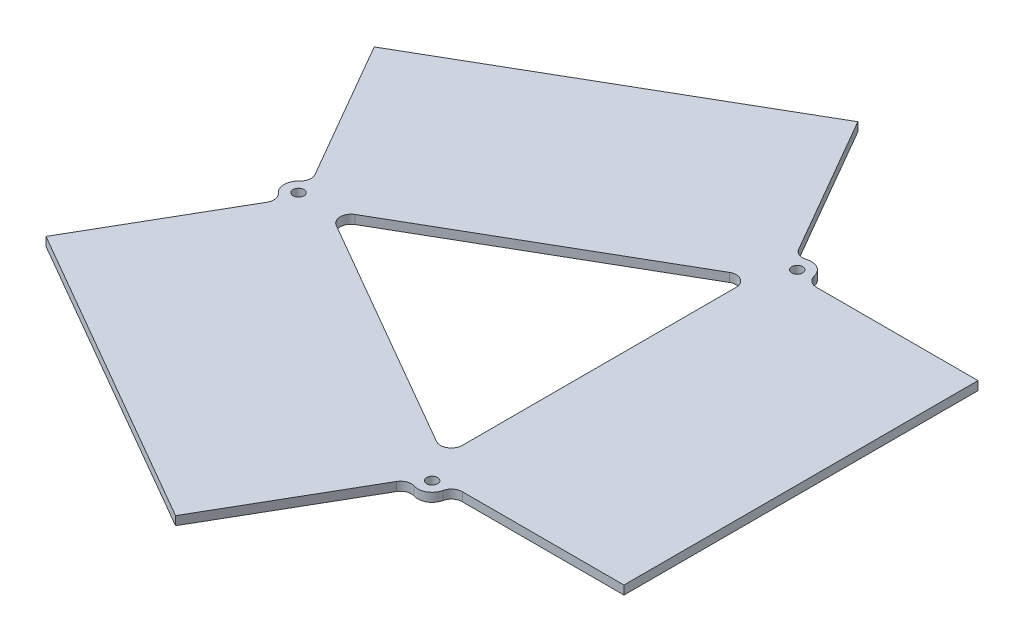
from build123d import *

# Parameters (mm, degrees)
SKETCH1_R           = 1.25
BOSS_EXTRUDE1_DEPTH = 2
FILLET1_R           = 2.5


with BuildPart() as part:
    # Sketch1 → Boss-Extrude1 (new body)
    with BuildSketch(Plane(origin=(0, 0, 0), x_dir=(1, 0, 0), z_dir=(0, 1, 0))):
        with BuildLine():
            Line((-103.965757813, 67.162425071), (-33.817700106, 107.662425071))
            Line((-33.817700106, 107.662425071), (-14.010882201, 73.356010123))
            ThreePointArc((-14.010882201, 73.356010123), (-9.775048525, 74.210673935), (-8.39729226, 70.115002459))
            Line((-8.39729226, 70.115002459), (31.216343551, 70.115002459))
            Line((31.216343551, 70.115002459), (31.216343551, -10.884997541))
            Line((31.216343551, -10.884997541), (-8.39729226, -10.884997541))
            ThreePointArc((-8.39729226, -10.884997541), (-9.775048525, -14.980669016), (-14.010882201, -14.126005204))
            Line((-14.010882201, -14.126005204), (-33.817700106, -48.432420153))
            Line((-33.817700106, -48.432420153), (-103.965757813, -7.932420153))
            Line((-103.965757813, -7.932420153), (-84.158939907, 26.373994796))
            ThreePointArc((-84.158939907, 26.373994796), (-87.017017318, 29.615002459), (-84.158939907, 32.856010123))
            Line((-84.158939907, 32.856010123), (-103.965757813, 67.162425071))
        make_face()
        with Locations(Location((-83.75035682, 29.615002459, 0), (0, 0, 270))):
            Circle(SKETCH1_R, mode=Mode.SUBTRACT)
        with Locations(Location((-11.408378774, 71.381662958, 0), (0, 0, 270))):
            Circle(SKETCH1_R, mode=Mode.SUBTRACT)
        with Locations(Location((-11.408378774, -12.151658039, 0), (0, 0, 270))):
            Circle(SKETCH1_R, mode=Mode.SUBTRACT)
        Polygon((-76.69928593, 29.615002459), (-14.933914219, 65.275256443), (-14.933914219, -6.045251524), align=None, mode=Mode.SUBTRACT)
    extrude(amount=BOSS_EXTRUDE1_DEPTH)

    # Fillet1
    fillet1_edges = [part.edges().sort_by_distance(p)[0] for p in [
        (-14.010882201, 1, -73.356010123),
        (-8.39729226, 1, -70.115002459),
        (-8.39729226, 1, 10.884997541),
        (-14.010882201, 1, 14.126005204),
        (-84.158939907, 1, -26.373994796),
        (-84.158939907, 1, -32.856010123),
        (-14.933914219, 1, -65.275256443),
        (-76.69928593, 1, -29.615002459),
        (-14.933914219, 1, 6.045251524),
    ]]
    fillet(fillet1_edges, radius=FILLET1_R)


solid = part.part
